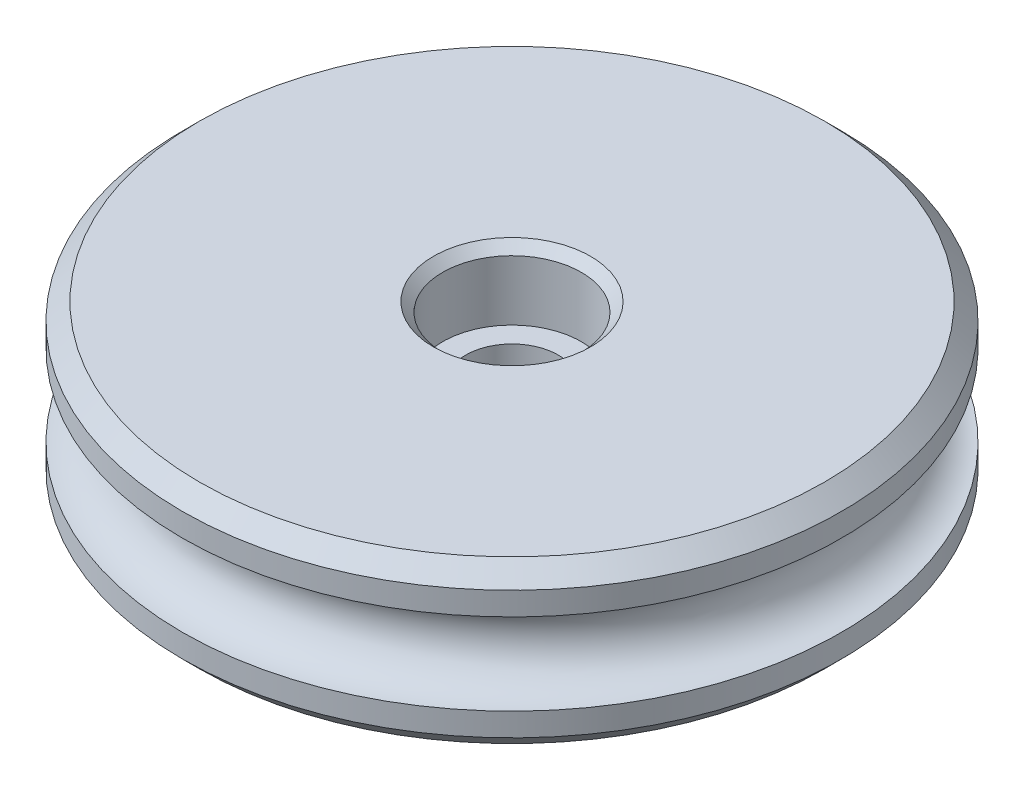
from build123d import *

# Parameters (mm, degrees)
CHAMFER1_SIZE = 0.4


with BuildPart() as part:
    # Sketch1 → Revolve1 (revolve)
    with BuildSketch(Plane(origin=(0, 0, 0), x_dir=(0, 0, -1), z_dir=(1, 0, 0))):
        with BuildLine():
            Line((-3, 3.5), (-13.5274, 3.5))
            Line((-13.5274, 3.5), (-14.2621, 2.7653))
            Line((-14.2621, 2.7653), (-14.2621, 1.7653))
            ThreePointArc((-14.2621, 1.7653), (-13.013844399, 1.248255601), (-12.4968, 0))
            Line((-12.4968, 0), (-2, 0))
            Line((-2, 0), (-2, 0.5))
            Line((-2, 0.5), (-3, 0.5))
            Line((-3, 0.5), (-3, 3.5))
        make_face()
    revolve1 = revolve(axis=Axis((0, 19.017402143, 0), (0, -1, 0)))

    # Mirror1: Revolve1 across plane
    add(revolve1.mirror(Plane.ZX))

    # Chamfer1
    chamfer1_edges = [part.edges().sort_by_distance(p)[0] for p in [
        (0, 3.5, -3),
        (0, -3.5, -3),
    ]]
    chamfer(chamfer1_edges, length=CHAMFER1_SIZE)


solid = part.part
